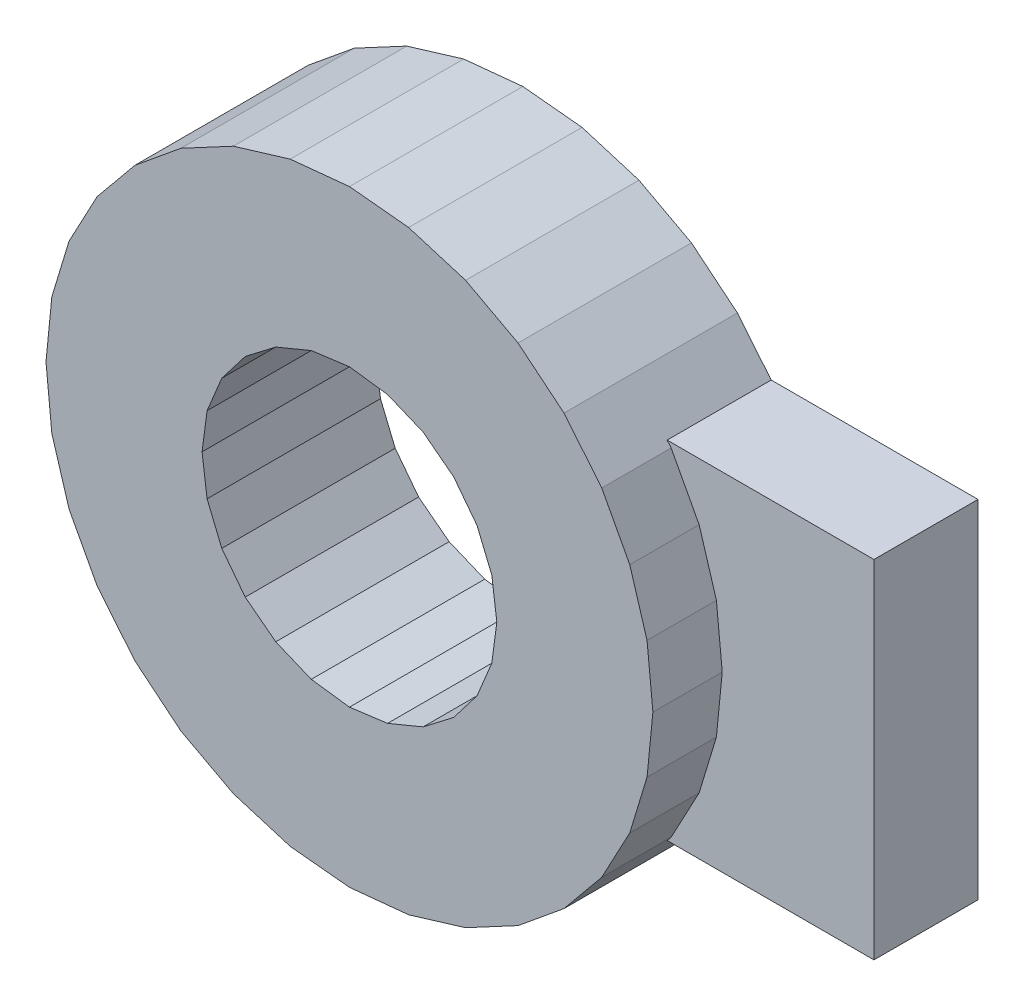
from build123d import *

# Parameters (mm, degrees)
BOSS_EXTRUDE1_DEPTH = 0.800000038
BOSS_EXTRUDE2_DEPTH = 1.200000057
CUT_EXTRUDE1_DEPTH  = 7.619101177


with BuildPart() as part:
    # Sketch1 → Boss-Extrude1 (new body)
    with BuildSketch(Plane.XY.offset(2.000000095)):
        Polygon((1.944495831, 2.910143696), (1.339392038, 3.233578522), (0.682816142, 3.432748606), (0, 3.500000108), (-0.682816142, 3.432748606), (-1.339392038, 3.233578522), (-1.944495831, 2.910143696), (-2.474873792, 2.474873792), (-2.910143696, 1.944495831), (-3.233578522, 1.339392038), (-3.432748606, 0.682816142), (-3.500000108, 0), (-3.432748606, -0.682816142), (-3.233578522, -1.339392038), (-2.910143696, -1.944495831), (-2.474873792, -2.474873792), (-1.944495831, -2.910143696), (-1.339392038, -3.233578522), (-0.682816142, -3.432748606), (0, -3.500000108), (0.682816142, -3.432748606), (1.339392038, -3.233578522), (1.944495831, -2.910143696), (2.474873792, -2.474873792), (2.910143696, -1.944495831), (3.233578522, -1.339392038), (3.432748606, -0.682816142), (3.500000108, 0), (3.432748606, 0.682816142), (3.233578522, 1.339392038), (2.910143696, 1.944495831), (2.474873792, 2.474873792), align=None)
    extrude(amount=-BOSS_EXTRUDE1_DEPTH)

    # Sketch2 → Boss-Extrude2 (add)
    with BuildSketch(Plane(origin=(0, 0, 1.200000057), x_dir=(-1, 0, 0), z_dir=(0, 0, -1))):
        Polygon((-5.249999929, -2.000000095), (-5.249999929, 2.000000095), (-2.864592476, 2.000000095), (-2.474873792, 2.474873792), (-1.944495831, 2.910143696), (-1.339392038, 3.233578522), (-0.682816142, 3.432748606), (0, 3.500000108), (0.682816142, 3.432748606), (1.339392038, 3.233578522), (1.944495831, 2.910143696), (2.474873792, 2.474873792), (2.910143696, 1.944495831), (3.233578522, 1.339392038), (3.432748606, 0.682816142), (3.500000108, 0), (3.432748606, -0.682816142), (3.233578522, -1.339392038), (2.910143696, -1.944495831), (2.474873792, -2.474873792), (1.944495831, -2.910143696), (1.339392038, -3.233578522), (0.682816142, -3.432748606), (0, -3.500000108), (-0.682816142, -3.432748606), (-1.339392038, -3.233578522), (-1.944495831, -2.910143696), (-2.474873792, -2.474873792), (-2.864592476, -2.000000095), align=None)
    extrude(amount=BOSS_EXTRUDE2_DEPTH)

    # Sketch3 → Cut-Extrude1 (cut, through all)
    with BuildSketch(Plane(origin=(0, 0, 0), x_dir=(-1, 0, 0), z_dir=(0, 0, -1))):
        Polygon((-1.472243224, 0.850000011), (-1.642073854, 0.439992378), (-1.700000023, 0), (-1.642073854, -0.439992378), (-1.472243224, -0.850000011), (-1.202081563, -1.202081563), (-0.850000011, -1.472243224), (-0.439992378, -1.642073854), (0, -1.700000023), (0.439992378, -1.642073854), (0.850000011, -1.472243224), (1.202081563, -1.202081563), (1.472243224, -0.850000011), (1.642073854, -0.439992378), (1.700000023, 0), (1.642073854, 0.439992378), (1.472243224, 0.850000011), (1.202081563, 1.202081563), (0.850000011, 1.472243224), (0.439992378, 1.642073854), (0, 1.700000023), (-0.439992378, 1.642073854), (-0.850000011, 1.472243224), (-1.202081563, 1.202081563), align=None)
    extrude(amount=-CUT_EXTRUDE1_DEPTH, mode=Mode.SUBTRACT)


solid = part.part
